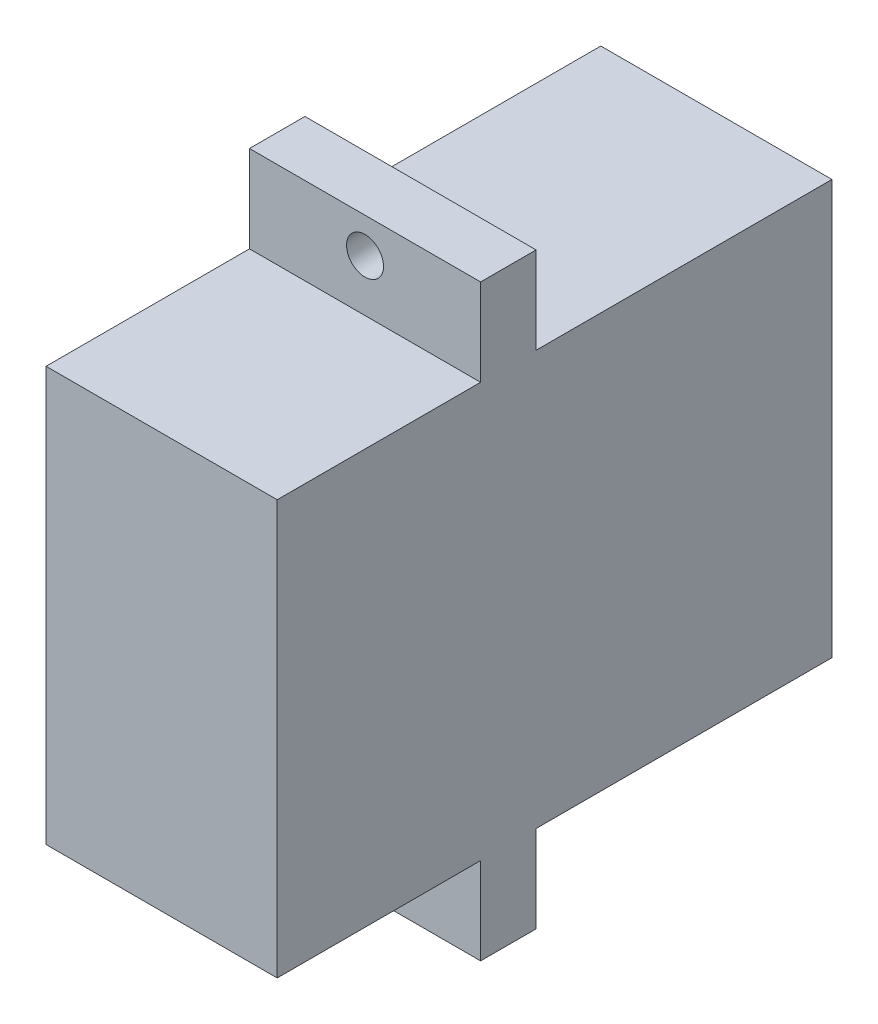
from build123d import *

# Parameters (mm, degrees)
SKETCH_1_W      = 12.5
SKETCH_1_H      = 31.8
SKETCH_1_R      = 1
EXTRUDE_1_DEPTH = 3
SKETCH_2_W      = 12.5
SKETCH_2_H      = 22.4
EXTRUDE_2_DEPTH = 11
SKETCH_3_W      = 12.5
SKETCH_3_H      = 22.4
EXTRUDE_4_DEPTH = 16


with BuildPart() as part:
    # 草图1 → 凸台-拉伸1 (new body)
    with BuildSketch(Plane.XY):
        with Locations((0, -14)):
            Rectangle(SKETCH_1_W, SKETCH_1_H)
        Circle(SKETCH_1_R, mode=Mode.SUBTRACT)
        with Locations((0, -28)):
            Circle(SKETCH_1_R, mode=Mode.SUBTRACT)
    extrude(amount=EXTRUDE_1_DEPTH)

    # 草图2 → 凸台-拉伸2 (add)
    with BuildSketch(Plane.XY.offset(3)):
        with Locations((0, -14)):
            Rectangle(SKETCH_2_W, SKETCH_2_H)
    extrude(amount=EXTRUDE_2_DEPTH)

    # 草图3 → 凸台-拉伸4 (add)
    with BuildSketch(Plane(origin=(0, 0, 0), x_dir=(-1, 0, 0), z_dir=(0, 0, -1))):
        with Locations((0, -14)):
            Rectangle(SKETCH_3_W, SKETCH_3_H)
    extrude(amount=EXTRUDE_4_DEPTH)


solid = part.part
